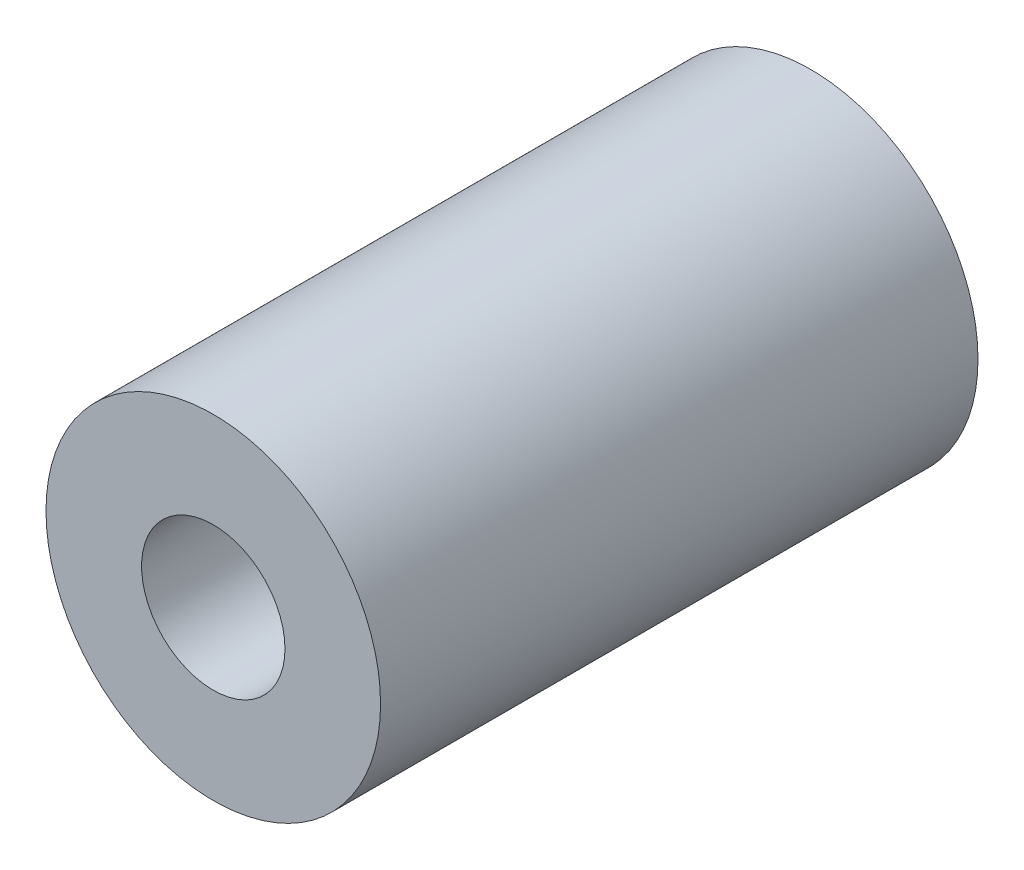
from build123d import *

# Parameters (mm, degrees)
SKETCH1_R           = 7
SKETCH1_R_2         = 3
BOSS_EXTRUDE1_DEPTH = 25


with BuildPart() as part:
    # Sketch1 → Boss-Extrude1 (new body)
    with BuildSketch(Plane(origin=(0, 0, 0), x_dir=(0, 1, 0), z_dir=(0, 0, 1))):
        with Locations(Location((0, 0, 0), (0, 0, 270))):
            Circle(SKETCH1_R)
        with Locations(Location((0, 0, 0), (0, 0, 270))):
            Circle(SKETCH1_R_2, mode=Mode.SUBTRACT)
    extrude(amount=BOSS_EXTRUDE1_DEPTH)


solid = part.part
